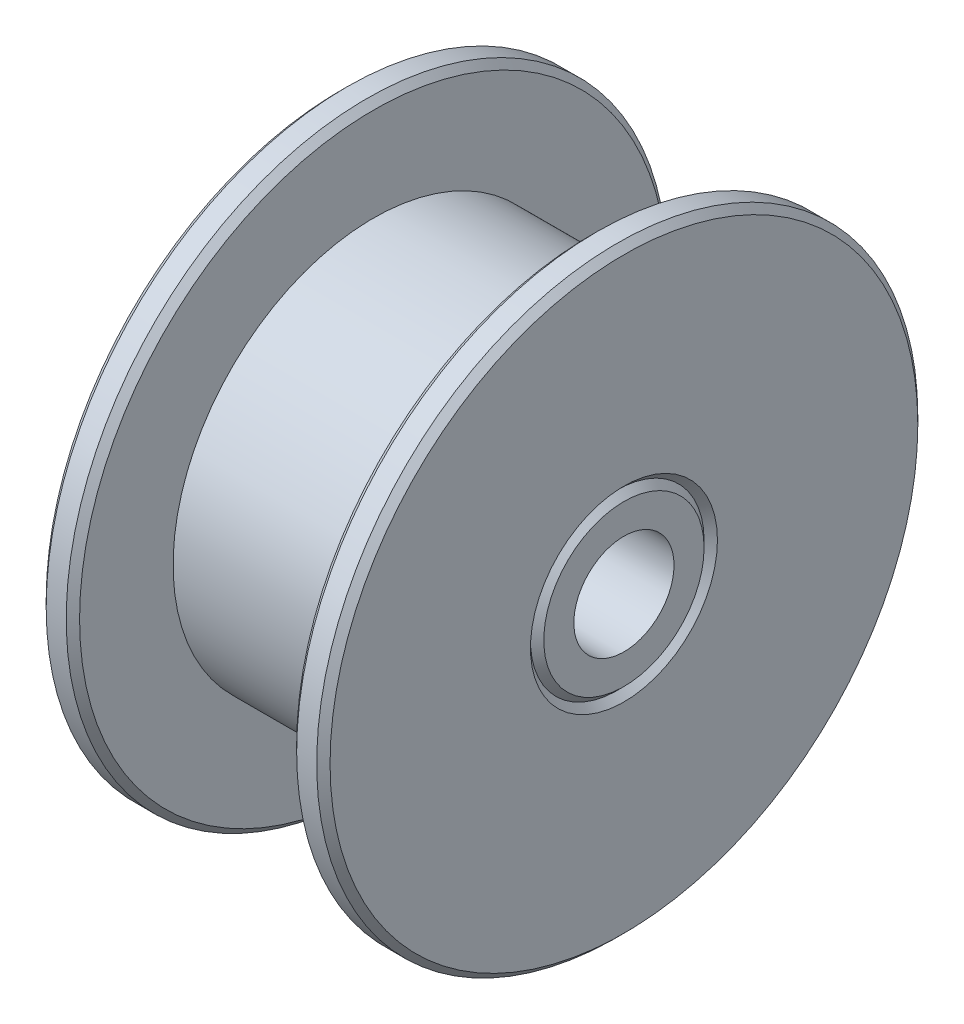
from build123d import *

# Parameters (mm, degrees)
CHAMFER1_SIZE = 0.2


with BuildPart() as part:
    # Sketch1 → Revolve1 (revolve)
    with BuildSketch(Plane.XY, mode=Mode.PRIVATE) as revolve1_sk:
        Polygon((-4.25, 1.5), (-4.25, 2.4), (-4.05, 2.6), (-4.25, 2.8), (-4.25, 9), (-3.25, 9), (-3.25, 6), (0, 6), (0, 1.5), align=None)
    revolve(revolve1_sk.sketch.rotate(Axis((0, 0, 0), (-1, 0, 0)), 90), axis=Axis((0, 0, 0), (-1, 0, 0)))

    # Mirror1: part across plane


with BuildPart() as part_1:
    add(part.part)
    add(part.part.mirror(Plane(origin=(0, 6, 0), x_dir=(0, 0, 1), z_dir=(1, 0, 0))))

    # Chamfer1
    chamfer1_edges = [part_1.edges().sort_by_distance(p)[0] for p in [
        (-4.25, 0, 9),
        (4.25, 0, 9),
        (3.25, 0, 9),
        (-3.25, 0, 9),
    ]]
    chamfer(chamfer1_edges, length=CHAMFER1_SIZE)


solid = part_1.part
